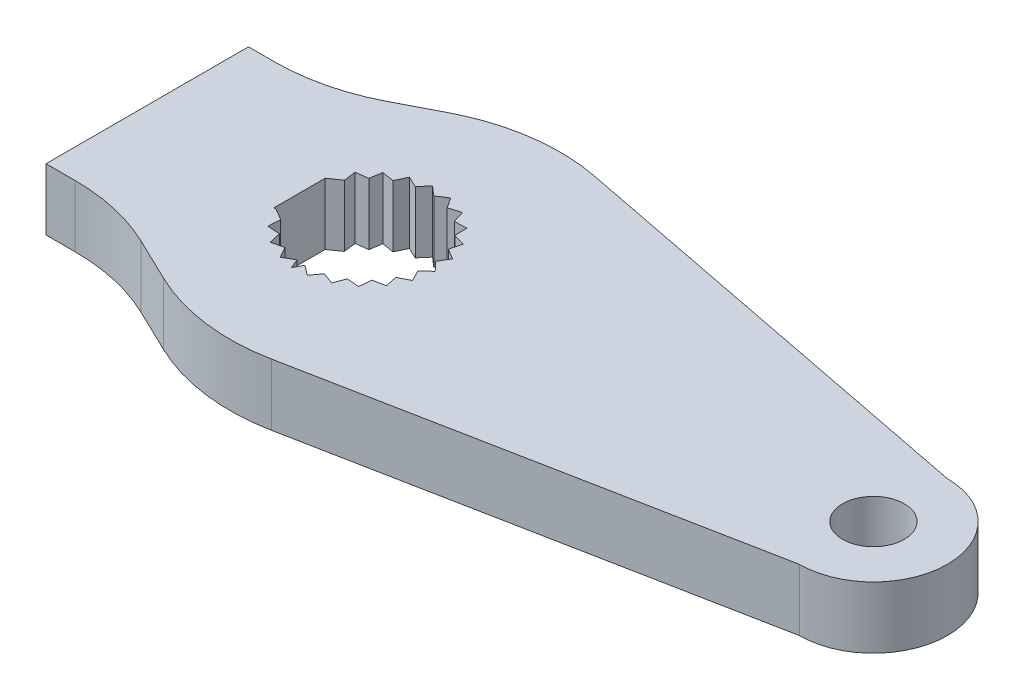
from build123d import *

# Parameters (mm, degrees)
BOSS_EXTRUDE1_DEPTH             = 6.35
CUT_EXTRUDE1_REACH              = 46.798
SKETCH2_R                       = 3.175
BOSS_EXTRUDE2_REACH             = 46.798
SKETCH3_W                       = 15.648651434
SKETCH3_H                       = 6.35
BOSS_EXTRUDE2_DIRECTION_2_REACH = 46.798


with BuildPart() as part:
    # Sketch1 → Boss-Extrude1 (new body)
    with BuildSketch(Plane(origin=(0, 0, 0), x_dir=(1, 0, 0), z_dir=(0, 1, 0))):
        with BuildLine():
            Line((-25.172750094, -2.854782141), (-23.979365131, -3.554335257))
            Line((-23.979365131, -3.554335257), (-24.045420885, -4.814754144))
            Line((-24.045420885, -4.814754144), (-22.785001999, -4.880809899))
            Line((-22.785001999, -4.880809899), (-22.501080336, -6.110609729))
            Line((-22.501080336, -6.110609729), (-21.271280506, -5.826688067))
            Line((-21.271280506, -5.826688067), (-20.659378714, -6.930588121))
            Line((-20.659378714, -6.930588121), (-19.555478659, -6.318686329))
            Line((-19.555478659, -6.318686329), (-19.145844879, -7.284635532))
            Line((-19.145844879, -7.284635532), (-18.663004813, -6.38109418))
            Line((-18.663004813, -6.38109418), (-17.655008108, -7.140674179))
            Line((-17.655008108, -7.140674179), (-16.895428108, -6.132677474))
            Line((-16.895428108, -6.132677474), (-15.717110864, -6.584991086))
            Line((-15.717110864, -6.584991086), (-15.264797252, -5.406673842))
            Line((-15.264797252, -5.406673842), (-14.00745149, -5.516677342))
            Line((-14.00745149, -5.516677342), (-13.89744799, -4.259331581))
            Line((-13.89744799, -4.259331581), (-12.658488598, -4.018502271))
            Line((-12.658488598, -4.018502271), (-12.899317907, -2.779542878))
            Line((-12.899317907, -2.779542878), (-11.774735254, -2.206539397))
            Line((-11.774735254, -2.206539397), (-12.347738736, -1.081956744))
            Line((-12.347738736, -1.081956744), (-11.424661673, -0.221173456))
            Line((-11.424661673, -0.221173456), (-12.28544496, 0.701903607))
            Line((-12.28544496, 0.701903607), (-11.635390366, 1.783776131))
            Line((-11.635390366, 1.783776131), (-12.717262889, 2.433830725))
            Line((-12.717262889, 2.433830725), (-12.390594789, 3.652972671))
            Line((-12.390594789, 3.652972671), (-13.609736736, 3.979640771))
            Line((-13.609736736, 3.979640771), (-13.631764267, 5.241597158))
            Line((-13.631764267, 5.241597158), (-14.893720653, 5.219569627))
            Line((-14.893720653, 5.219569627), (-15.262737196, 6.426568353))
            Line((-15.262737196, 6.426568353), (-16.469735922, 6.05755181))
            Line((-16.469735922, 6.05755181), (-17.157151327, 7.116078708))
            Line((-17.157151327, 7.116078708), (-18.215678225, 6.428663303))
            Line((-18.215678225, 6.428663303), (-19.168233878, 7.256707299))
            Line((-19.168233878, 7.256707299), (-19.996277875, 6.304151646))
            Line((-19.996277875, 6.304151646), (-21.140172995, 6.837558701))
            Line((-21.140172995, 6.837558701), (-21.67358005, 5.69366358))
            Line((-21.67358005, 5.69366358), (-22.920189524, 5.891107124))
            Line((-22.920189524, 5.891107124), (-23.117633068, 4.64449765))
            Line((-23.117633068, 4.64449765), (-24.370373821, 4.490680427))
            Line((-24.370373821, 4.490680427), (-24.216556598, 3.237939674))
            Line((-24.216556598, 3.237939674), (-25.378370526, 2.412676209))
            Line((-25.378370526, 2.412676209), (-41.02702196, 2.557572596))
            Line((-41.02702196, 2.557572596), (-41.02702196, 10.177572596))
            Line((-41.02702196, 10.177572596), (-38.355583111, 10.177572596))
            ThreePointArc((-38.355583111, 10.177572596), (-33.547545085, 10.754594848), (-29.012572504, 12.452890476))
            Line((-29.012572504, 12.452890476), (-24.949455261, 14.556654192))
            ThreePointArc((-24.949455261, 14.556654192), (-18.492857296, 16.625923003), (-11.714907277, 16.455851756))
            Line((-11.714907277, 16.455851756), (33.40702196, 7.651462795))
            ThreePointArc((33.40702196, 7.651462795), (41.02702196, 0.031462795), (33.40702196, -7.588537205))
            Line((33.40702196, -7.588537205), (-12.038677684, -16.4558708))
            ThreePointArc((-12.038677684, -16.4558708), (-18.523682802, -16.66577615), (-24.744249109, -14.820808279))
            Line((-24.744249109, -14.820808279), (-29.229404705, -12.661591197))
            ThreePointArc((-29.229404705, -12.661591197), (-33.523201838, -11.159597642), (-38.043536354, -10.650427404))
            Line((-38.043536354, -10.650427404), (-41.02702196, -10.650427404))
            Line((-41.02702196, -10.650427404), (-41.02702196, -3.030427404))
            Line((-41.02702196, -3.030427404), (-25.172750094, -2.854782141))
        make_face()
    extrude(amount=BOSS_EXTRUDE1_DEPTH)

    # Sketch2 → Cut-Extrude1 (cut, up to next)
    with BuildSketch(Plane(origin=(0, 6.35, 0), x_dir=(1, 0, 0), z_dir=(0, 1, 0)), mode=Mode.PRIVATE) as cut_extrude1_sk1:
        with Locations(Location((33.40702196, 0.031462795, 0), (0, 0, 270))):
            Circle(SKETCH2_R)
    cut_extrude1_tool1 = extrude(cut_extrude1_sk1.sketch, amount=-CUT_EXTRUDE1_REACH, mode=Mode.PRIVATE) & part.part
    add(cut_extrude1_tool1.solids().sort_by_distance((33.407022, 6.35, -0.031463))[0], mode=Mode.SUBTRACT)

    # Sketch3 → Boss-Extrude2 (add, up to next)
    with BuildSketch(Plane.XY, mode=Mode.PRIVATE) as boss_extrude2_sk1:
        with Locations((-33.202696243, 3.175)):
            Rectangle(SKETCH3_W, SKETCH3_H)
    boss_extrude2_tool1 = extrude(boss_extrude2_sk1.sketch, amount=BOSS_EXTRUDE2_REACH, mode=Mode.PRIVATE) - part.part
    add(boss_extrude2_tool1.solids().sort_by_distance((-33.202696, 3.175, 0))[0])

    # Sketch3 → Boss-Extrude2 direction 2 (add, up to next)
    with BuildSketch(Plane.XY, mode=Mode.PRIVATE) as boss_extrude2_direction_2_sk1:
        with Locations((-33.202696243, 3.175)):
            Rectangle(SKETCH3_W, SKETCH3_H)
    boss_extrude2_direction_2_tool1 = extrude(boss_extrude2_direction_2_sk1.sketch, amount=-BOSS_EXTRUDE2_DIRECTION_2_REACH, mode=Mode.PRIVATE) - part.part
    add(boss_extrude2_direction_2_tool1.solids().sort_by_distance((-33.202696, 3.175, 0))[0])


solid = part.part
